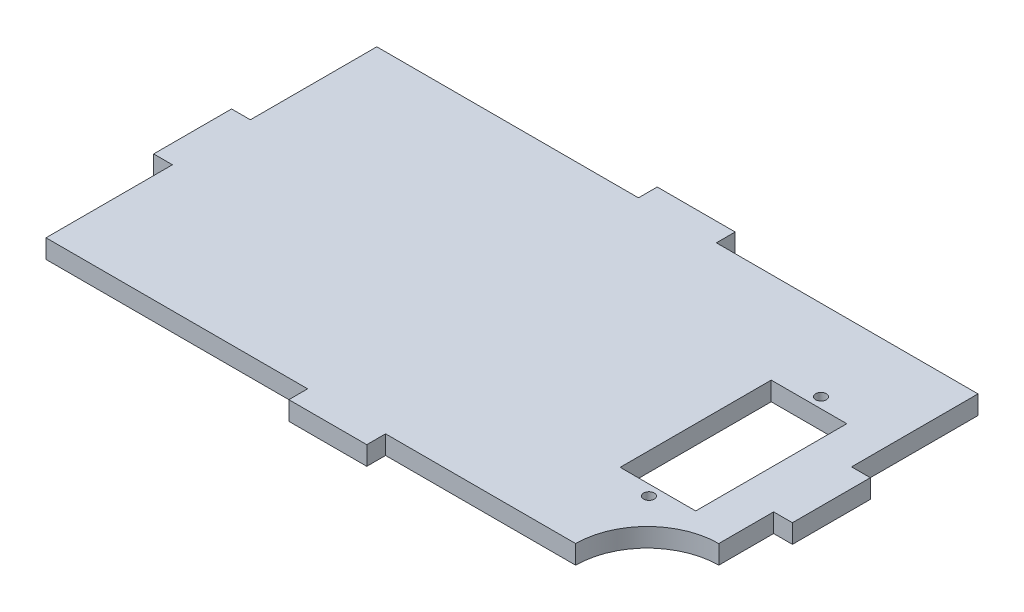
from build123d import *

# Parameters (mm, degrees)
BOSS_EXTRUDE1_DEPTH = 3
SKETCH3_W           = 12.065
SKETCH3_H           = 24.13
CUT_EXTRUDE1_DEPTH  = 114.708347838
CUT_EXTRUDE3_DEPTH  = 114.708347838
SKETCH5_R           = 0.8509
CUT_EXTRUDE4_DEPTH  = 114.708347838


with BuildPart() as part:
    # Sketch1 → Boss-Extrude1 (new body)
    with BuildSketch(Plane(origin=(0, 0, 0), x_dir=(1, 0, 0), z_dir=(0, 1, 0))):
        Polygon((0, 0), (0, 20.193), (-3, 20.193), (-3, 32.639), (0, 32.639), (0, 52.832), (41.783, 52.832), (41.783, 55.832), (54.229, 55.832), (54.229, 52.832), (96.012, 52.832), (96.012, 32.639), (99.012, 32.639), (99.012, 20.193), (96.012, 20.193), (96.012, 0), (54.229, 0), (54.229, -3), (41.783, -3), (41.783, 0), align=None)
    extrude(amount=BOSS_EXTRUDE1_DEPTH)

    # Sketch3 → Cut-Extrude1 (cut, through all)
    with BuildSketch(Plane(origin=(0, 3, 0), x_dir=(1, 0, 0), z_dir=(0, 1, 0))):
        with Locations((83.6295, 26.162)):
            Rectangle(SKETCH3_W, SKETCH3_H)
    extrude(amount=-CUT_EXTRUDE1_DEPTH, mode=Mode.SUBTRACT)

    # Sketch4 → Cut-Extrude3 (cut, through all)
    with BuildSketch(Plane(origin=(0, 3, 0), x_dir=(1, 0, 0), z_dir=(0, 1, 0))):
        with BuildLine():
            Line((96.012, 11.43), (96.012, 0))
            Line((96.012, 0), (84.582, 0))
            ThreePointArc((84.582, 0), (87.929769491, 8.082230509), (96.012, 11.43))
        make_face()
    extrude(amount=-CUT_EXTRUDE3_DEPTH, mode=Mode.SUBTRACT)

    # Sketch5 → Cut-Extrude4 (cut, through all)
    with BuildSketch(Plane(origin=(0, 3, 0), x_dir=(1, 0, 0), z_dir=(0, 1, 0))):
        with Locations(Location((83.8708, 39.9034, 0), (0, 0, 270))):
            Circle(SKETCH5_R)
        with Locations(Location((83.8708, 12.4206, 0), (0, 0, 270))):
            Circle(SKETCH5_R)
    extrude(amount=-CUT_EXTRUDE4_DEPTH, mode=Mode.SUBTRACT)


solid = part.part
